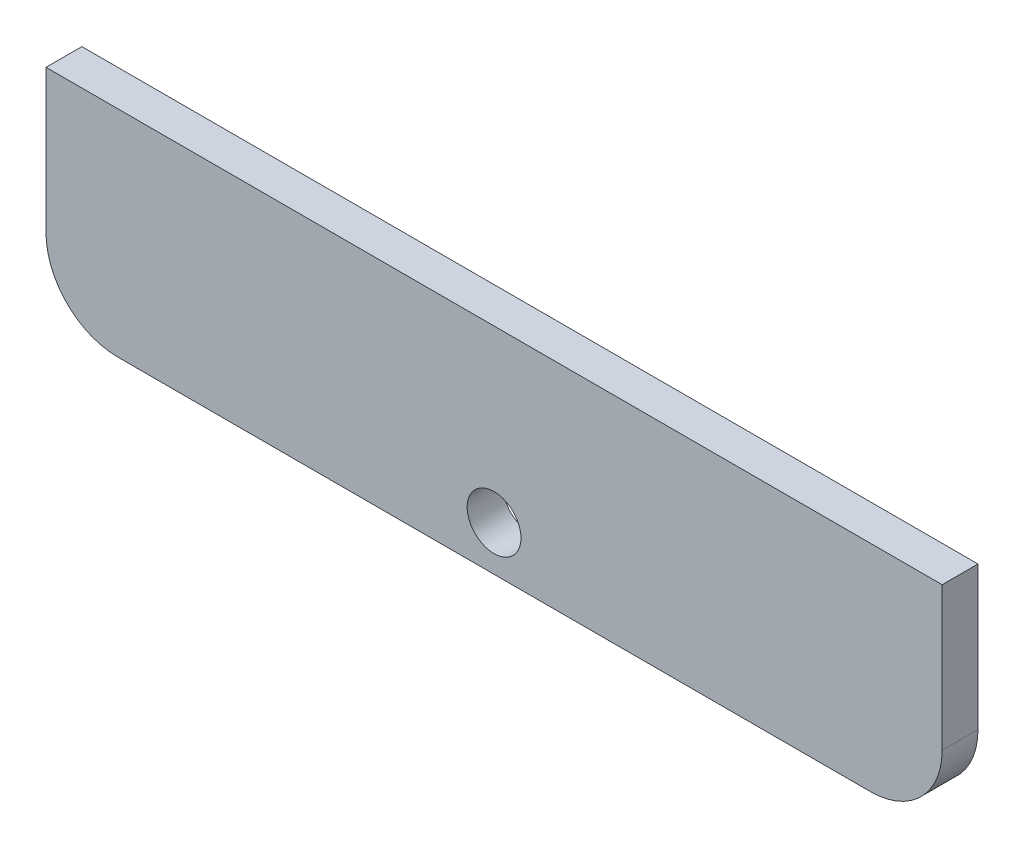
from build123d import *

# Parameters (mm, degrees)
SKETCH1_R           = 1.5
BOSS_EXTRUDE1_DEPTH = 1


with BuildPart() as part:
    # Sketch1 → Boss-Extrude1 (new, symmetric)
    with BuildSketch(Plane.XY):
        with BuildLine():
            Line((-21, -2.5), (21, -2.5))
            ThreePointArc((21, -2.5), (23.828427125, -1.328427125), (25, 1.5))
            Line((25, 1.5), (25, 9.5))
            Line((25, 9.5), (-25, 9.5))
            Line((-25, 9.5), (-25, 1.5))
            ThreePointArc((-25, 1.5), (-23.828427125, -1.328427125), (-21, -2.5))
        make_face()
        Circle(SKETCH1_R, mode=Mode.SUBTRACT)
    extrude(amount=BOSS_EXTRUDE1_DEPTH, both=True)


solid = part.part
